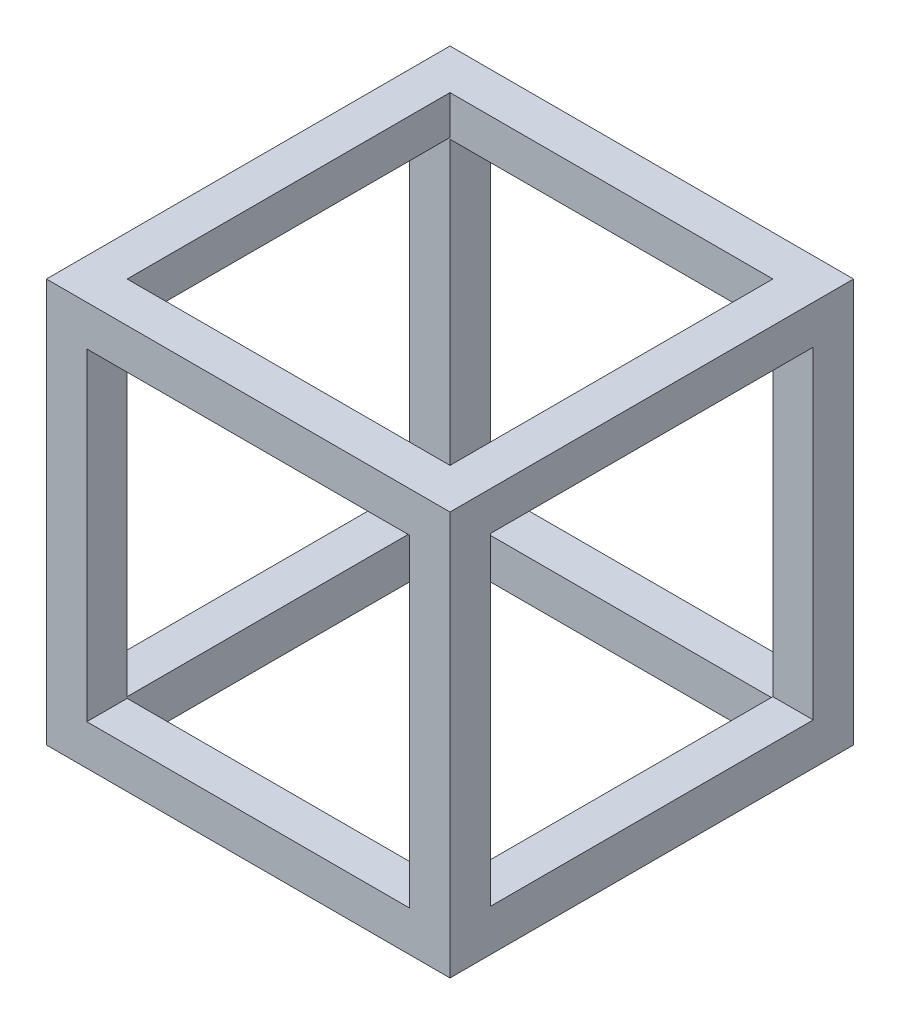
from build123d import *

# Parameters (mm, degrees)
SKETCH1_W           = 1
SKETCH1_H           = 1
BOSS_EXTRUDE1_DEPTH = 1
SKETCH2_W           = 0.8
SKETCH2_H           = 0.8
CUT_EXTRUDE2_DEPTH  = 2.5
SKETCH3_W           = 0.8
SKETCH3_H           = 0.8
CUT_EXTRUDE3_DEPTH  = 2.5
SKETCH4_W           = 0.8
SKETCH4_H           = 0.8
CUT_EXTRUDE4_DEPTH  = 2.224744871


with BuildPart() as part:
    # Sketch1 → Boss-Extrude1 (new body)
    with BuildSketch(Plane(origin=(0, 0, 0), x_dir=(1, 0, 0), z_dir=(0, 1, 0))):
        Rectangle(SKETCH1_W, SKETCH1_H)
    extrude(amount=BOSS_EXTRUDE1_DEPTH)

    # Sketch2 → Cut-Extrude2 (cut, through all)
    with BuildSketch(Plane(origin=(0.5, 0, 0), x_dir=(0, 0, -1), z_dir=(1, 0, 0))):
        with Locations((0, 0.503735105)):
            Rectangle(SKETCH2_W, SKETCH2_H)
    extrude(amount=-CUT_EXTRUDE2_DEPTH, mode=Mode.SUBTRACT)

    # Sketch3 → Cut-Extrude3 (cut, through all)
    with BuildSketch(Plane.XY.offset(0.5)):
        with Locations((0, 0.5)):
            Rectangle(SKETCH3_W, SKETCH3_H)
    extrude(amount=-CUT_EXTRUDE3_DEPTH, mode=Mode.SUBTRACT)

    # Sketch4 → Cut-Extrude4 (cut, through all)
    with BuildSketch(Plane(origin=(0, 1, 0), x_dir=(1, 0, 0), z_dir=(0, 1, 0))):
        Rectangle(SKETCH4_W, SKETCH4_H)
    extrude(amount=-CUT_EXTRUDE4_DEPTH, mode=Mode.SUBTRACT)


solid = part.part
